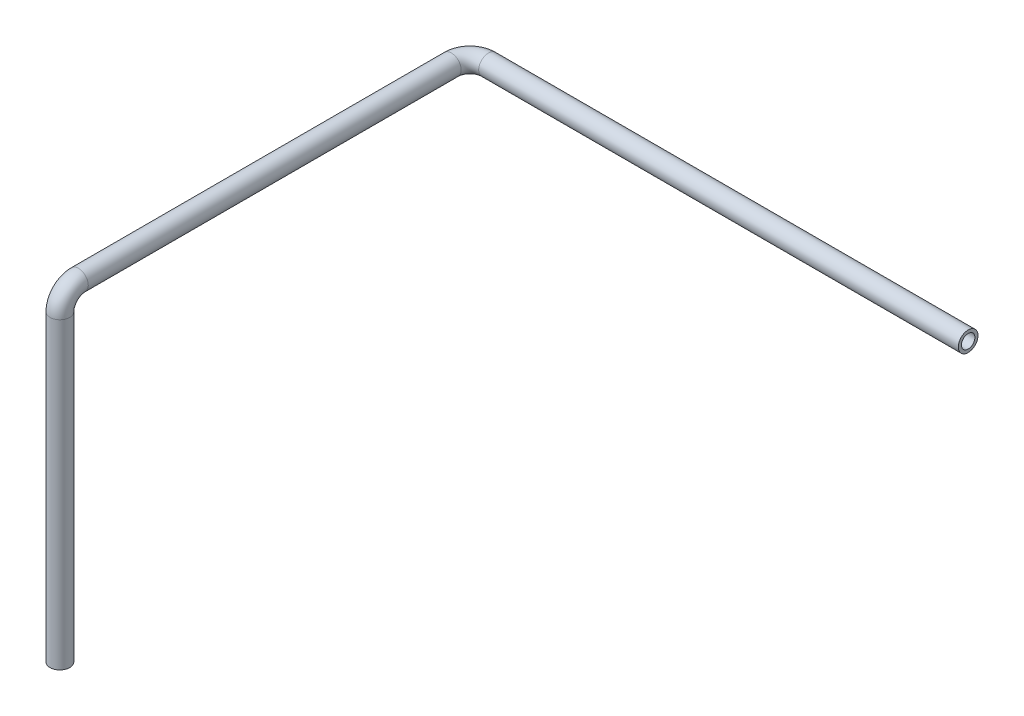
from build123d import *

# Parameters (mm, degrees)
TUBE_PROFILE_R   = 3.175
TUBE_PROFILE_R_2 = 2.175


with BuildPart() as part:
    # Tube: sweep along a curve in space
    with BuildLine() as tube_path:
        Line((-150, 237, 200), (-150, 335, 200))
        ThreePointArc((-150, 341, 194), (-150, 339.242640687, 198.242640687), (-150, 335, 200))
        Line((-150, 341, 194), (-150, 341, 73.5))
        ThreePointArc((-144, 341, 67.5), (-148.242640687, 341, 69.257359313), (-150, 341, 73.5))
        Line((-144, 341, 67.5), (11, 341, 67.5))
    # Tube profile (on start of the path) → Tube (sweep)
    with BuildSketch(Plane(origin=(-150, 237, 200), x_dir=(0, 0, 1), z_dir=(0, 1, 0))):
        Circle(TUBE_PROFILE_R)
        Circle(TUBE_PROFILE_R_2, mode=Mode.SUBTRACT)
    sweep(path=tube_path.line)


solid = part.part
